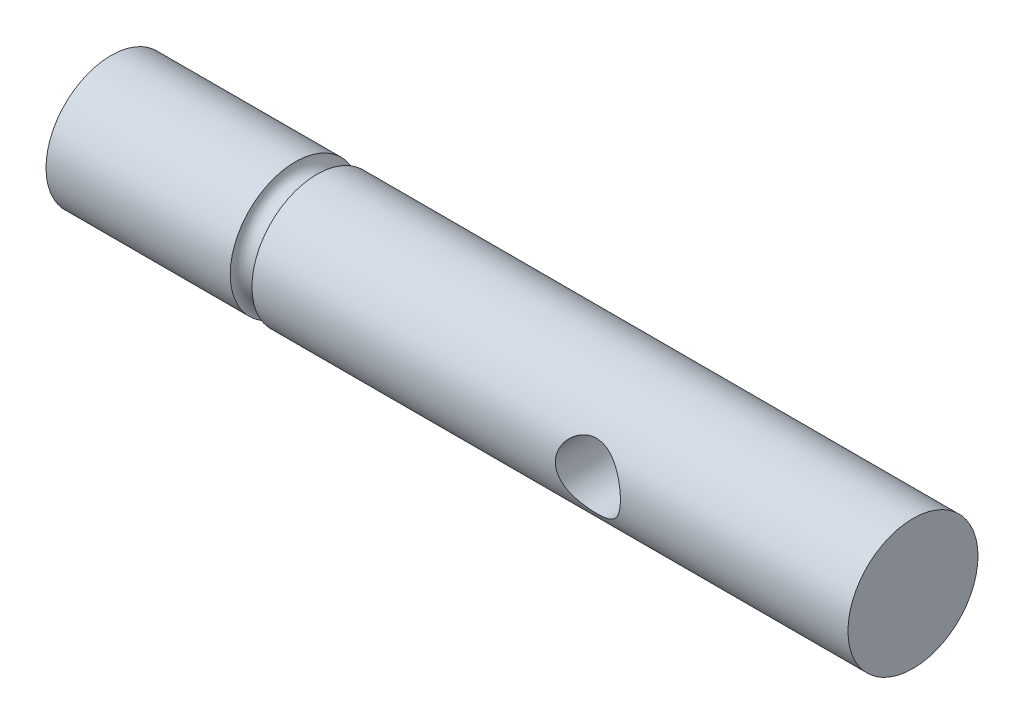
from build123d import *

# Parameters (mm, degrees)
SKETCH1_R               = 3
BOSS_EXTRUDE1_DEPTH     = 18.5
CUT_EXTRUDE1_DEPTH      = 19.980252896
CUT_EXTRUDE1_DEPTH_BACK = 19.980252896
SKETCH2_R               = 1.5
CUT_SWEEP1_PROFILE_R    = 0.5


with BuildPart() as part:
    # Sketch1 → Boss-Extrude1 (new, symmetric)
    with BuildSketch(Plane.YZ):
        with Locations(Location((0, 0, 0), (0, 0, 270))):
            Circle(SKETCH1_R)
    extrude(amount=BOSS_EXTRUDE1_DEPTH, both=True)

    # Sketch2 → Cut-Extrude1 (cut, two sides: drawn at the far end of the back side and taken through both)
    with BuildSketch(Plane(origin=(0, 0, 0), x_dir=(0, 1, 0), z_dir=(0, 0, 1)).offset(-CUT_EXTRUDE1_DEPTH_BACK)):
        with Locations(Location((0, -6.5, 0), (0, 0, 270))):
            Circle(SKETCH2_R)
    extrude(amount=CUT_EXTRUDE1_DEPTH + CUT_EXTRUDE1_DEPTH_BACK, mode=Mode.SUBTRACT)

    # Cut-Sweep1: sweep along a path in Sketch3
    with BuildLine(Plane(origin=(-9.5, 0, 0), x_dir=(0, -1, 0), z_dir=(-1, 0, 0))) as cut_sweep1_path:
        CenterArc((0, 0), 3, 0, 360)
    # Cut-Sweep1 profile (on start of the path) → Cut-Sweep1 (sweep, cut)
    with BuildSketch(Plane(origin=(-9.5, -3, 0), x_dir=(1, 0, 0), z_dir=(0, 0, 1))):
        Circle(CUT_SWEEP1_PROFILE_R)
    sweep(path=cut_sweep1_path.line, mode=Mode.SUBTRACT)


solid = part.part
